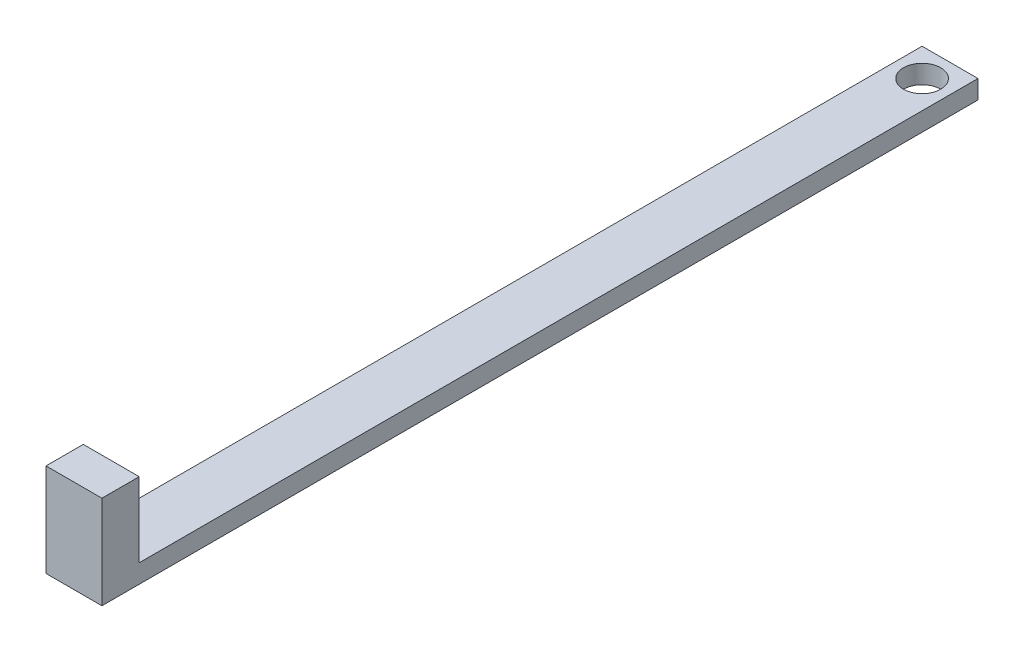
from build123d import *

# Parameters (mm, degrees)
BOSS_EXTRUDE1_DEPTH = 30
SKETCH2_R           = 10
CUT_EXTRUDE1_DEPTH  = 10


with BuildPart() as part:
    # Sketch1 → Boss-Extrude1 (new body)
    with BuildSketch(Plane(origin=(0, 0, 0), x_dir=(0, 0, -1), z_dir=(1, 0, 0))):
        Polygon((0, 40), (0, 0), (450, 0), (450, -10), (-20, -10), (-20, 40), align=None)
    extrude(amount=BOSS_EXTRUDE1_DEPTH)

    # Sketch2 → Cut-Extrude1 (cut)
    with BuildSketch(Plane(origin=(0, 0, 0), x_dir=(1, 0, 0), z_dir=(0, 1, 0))):
        with Locations(Location((15, 435, 0), (0, 0, 270))):
            Circle(SKETCH2_R)
    extrude(amount=-CUT_EXTRUDE1_DEPTH, mode=Mode.SUBTRACT)


solid = part.part
